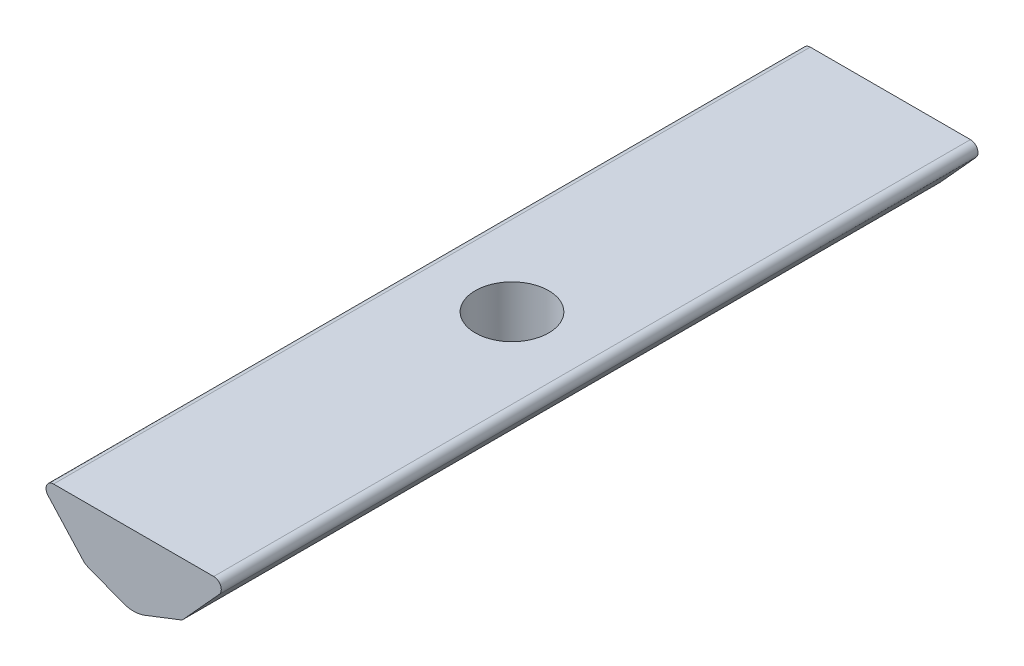
from build123d import *

# Parameters (mm, degrees)
BOSS_EXTRUDE1_DEPTH = 50
SKETCH3_R           = 2.425
CUT_EXTRUDE1_DEPTH  = 51.547558199


with BuildPart() as part:
    # Sketch2 → Boss-Extrude1 (new body)
    with BuildSketch(Plane.XY):
        with BuildLine():
            Line((-5.290927929, 9.35), (5.290927929, 9.35))
            ThreePointArc((5.290927929, 9.35), (5.748105268, 9.052457111), (5.661163141, 8.513955526))
            Line((5.661163141, 8.513955526), (3.289191157, 5.900648009))
            ThreePointArc((3.289191157, 5.900648009), (3.202240303, 5.824685234), (3.100183828, 5.770691994))
            Line((3.100183828, 5.770691994), (0.724911529, 4.846947106))
            ThreePointArc((0.724911529, 4.846947106), (0, 4.710949058), (-0.724911529, 4.846947106))
            Line((-0.724911529, 4.846947106), (-3.100183828, 5.770691994))
            ThreePointArc((-3.100183828, 5.770691994), (-3.202240303, 5.824685234), (-3.289191157, 5.900648009))
            Line((-3.289191157, 5.900648009), (-5.661163141, 8.513955526))
            ThreePointArc((-5.661163141, 8.513955526), (-5.748105268, 9.052457111), (-5.290927929, 9.35))
        make_face()
    extrude(amount=BOSS_EXTRUDE1_DEPTH)

    # Sketch3 → Cut-Extrude1 (cut, through all)
    with BuildSketch(Plane(origin=(0, 9.35, 0), x_dir=(1, 0, 0), z_dir=(0, 1, 0))):
        with Locations(Location((0, -25, 0), (0, 0, 270))):
            Circle(SKETCH3_R)
    extrude(amount=-CUT_EXTRUDE1_DEPTH, mode=Mode.SUBTRACT)


solid = part.part
